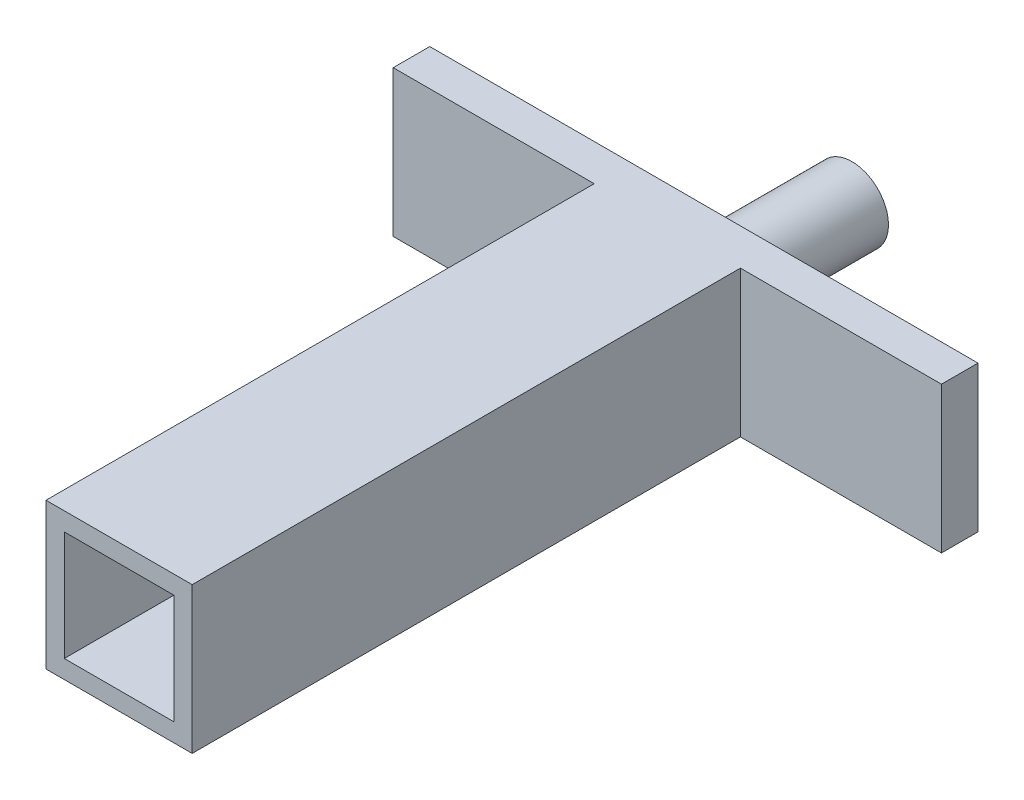
from build123d import *

# Parameters (mm, degrees)
SKETCH_8_W      = 4
SKETCH_8_H      = 4
EXTRUDE_5_DEPTH = 16
SHELL_2_T       = -0.5
SKETCH_9_R      = 1
EXTRUDE_6_DEPTH = 4
SKETCH_10_R     = 1
SKETCH_10_R_2   = 0.849026748
EXTRUDE_7_DEPTH = 0.05
SKETCH_11_W     = 5.5
SKETCH_11_H     = 4
EXTRUDE_8_DEPTH = 1


with BuildPart() as part:
    # Эскиз8 → Бобышка-Вытянуть5 (new body)
    with BuildSketch(Plane.XY):
        Rectangle(SKETCH_8_W, SKETCH_8_H)
    extrude(amount=EXTRUDE_5_DEPTH)

    # Оболочка2
    shell_2_openings = [part.faces().sort_by_distance(p)[0] for p in [
        (0, 0, 16),
    ]]
    offset(amount=SHELL_2_T, openings=shell_2_openings, kind=Kind.INTERSECTION)

    # Эскиз9 → Бобышка-Вытянуть6 (add)
    with BuildSketch(Plane(origin=(0, 0, 0), x_dir=(-1, 0, 0), z_dir=(0, 0, -1))):
        Circle(SKETCH_9_R)
    extrude(amount=EXTRUDE_6_DEPTH)

    # Эскиз10 → Бобышка-Вытянуть7 (add)
    # profile 1 of 2: a face of its own
    with BuildSketch(Plane(origin=(0, 0, -4), x_dir=(-1, 0, 0), z_dir=(0, 0, -1))):
        Circle(SKETCH_10_R)
        Circle(SKETCH_10_R_2, mode=Mode.SUBTRACT)
    # profile 2 of 2: a face of its own
    with BuildSketch(Plane(origin=(0, 0, -4), x_dir=(-1, 0, 0), z_dir=(0, 0, -1))):
        with BuildLine():
            ThreePointArc((0, 0.556564641), (0.047474291, 0.655228966), (0.15419684, 0.679698432))
            ThreePointArc((0.15419684, 0.679698432), (0.6969696, 0), (0.15419684, -0.679698432))
            ThreePointArc((0.15419684, -0.679698432), (0.047474291, -0.655228966), (0, -0.556564641))
            Line((0, -0.556564641), (0, 0.556564641))
        make_face()
    extrude(amount=EXTRUDE_7_DEPTH)

    # Эскиз11 → Бобышка-Вытянуть8 (add)
    with BuildSketch(Plane(origin=(0, 0, 0), x_dir=(-1, 0, 0), z_dir=(0, 0, -1))):
        with Locations((-4.75, 0)):
            Rectangle(SKETCH_11_W, SKETCH_11_H)
        with Locations((4.75, 0)):
            Rectangle(SKETCH_11_W, SKETCH_11_H)
    extrude(amount=-EXTRUDE_8_DEPTH)


solid = part.part
